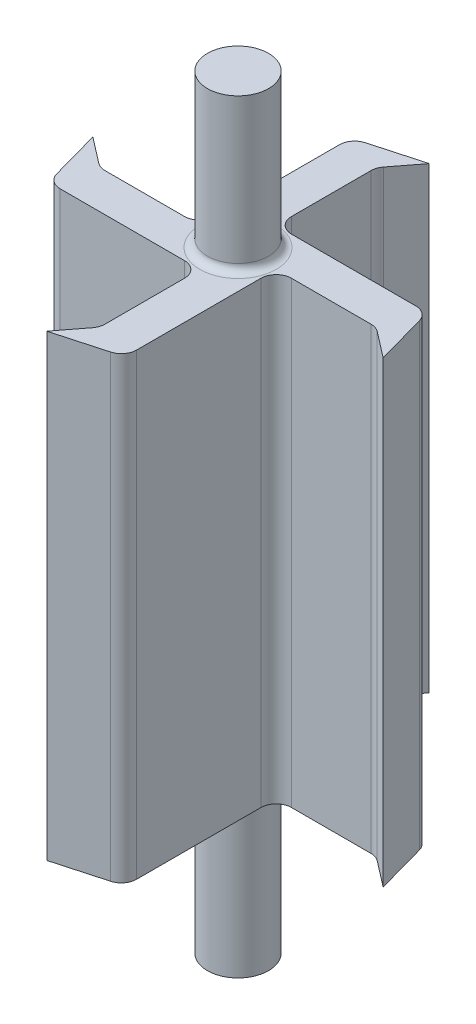
from build123d import *

# Parameters (mm, degrees)
BOSS_EXTRUDE1_DEPTH = 60
FILLET1_R           = 2
SKETCH3_R           = 1.870137446
CUT_EXTRUDE1_DEPTH  = 60
SKETCH4_R           = 4
BOSS_EXTRUDE2_DEPTH = 50
FILLET2_R           = 1


with BuildPart() as part:
    # Sketch2 → Boss-Extrude1 (new body)
    with BuildSketch(Plane(origin=(0, 0, 0), x_dir=(1, 0, 0), z_dir=(0, 1, 0))):
        Polygon((-5, 0), (-5, 19.790786282), (3.017767954, 22.016679806), (0, 18.09611266), (0, 5), (19.790786282, 5), (22.016679806, -3.017767954), (18.09611266, 0), (5, 0), (5, -19.790786282), (-3.017767954, -22.016679806), (0, -18.09611266), (0, -5), (-19.790786282, -5), (-22.016679806, 3.017767954), (-18.09611266, 0), align=None)
    extrude(amount=BOSS_EXTRUDE1_DEPTH)

    # Fillet1
    fillet1_edges = [part.edges().sort_by_distance(p)[0] for p in [
        (19.790786282, 30, -5),
        (18.09611266, 30, 0),
        (5, 30, 0),
        (5, 30, 19.790786282),
        (0, 30, 18.09611266),
        (0, 30, 5),
        (-19.790786282, 30, 5),
        (-18.09611266, 30, 0),
        (-5, 30, 0),
        (-5, 30, -19.790786282),
        (0, 30, -18.09611266),
        (0, 30, -5),
    ]]
    fillet(fillet1_edges, radius=FILLET1_R)

    # Sketch3 → Cut-Extrude1 (cut)
    with BuildSketch(Plane(origin=(0, 60, 0), x_dir=(1, 0, 0), z_dir=(0, 1, 0))):
        with Locations(Location((0, 0, 0), (0, 0, 270))):
            Circle(SKETCH3_R)
    extrude(amount=-CUT_EXTRUDE1_DEPTH, mode=Mode.SUBTRACT)

    # Sketch4 → Boss-Extrude2 (add, symmetric)
    with BuildSketch(Plane(origin=(0, 30, 0), x_dir=(1, 0, 0), z_dir=(0, 1, 0))):
        with Locations(Location((0, 0, 0), (0, 0, 270))):
            Circle(SKETCH4_R)
    extrude(amount=BOSS_EXTRUDE2_DEPTH, both=True)

    # Fillet2
    fillet2_edges = [part.edges().sort_by_distance(p)[0] for p in [
        (0, 0, -4),
        (0, 60, -4),
    ]]
    fillet(fillet2_edges, radius=FILLET2_R)


solid = part.part
